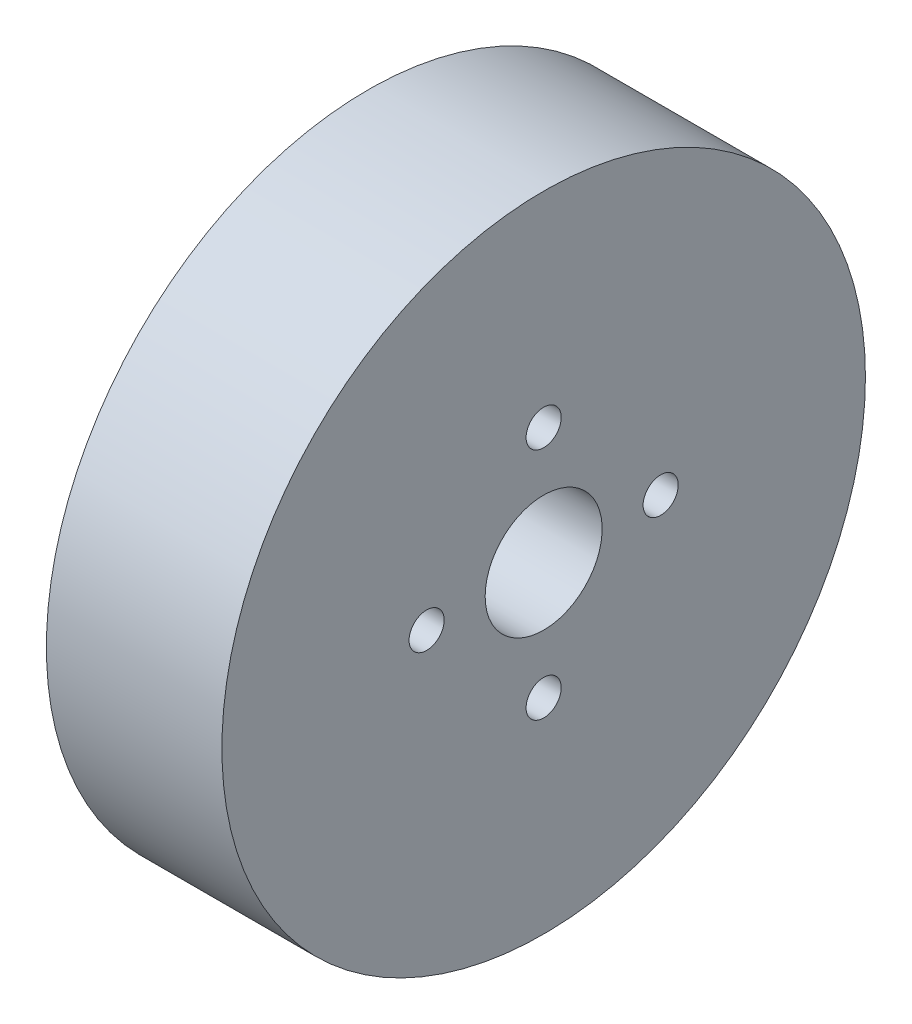
from build123d import *

# Parameters (mm, degrees)
SKETCH_1_R          = 27.5
EXTRUDE_1_DEPTH     = 15
CUT_EXTRUDE_1_REACH = 65.997
SKETCH_2_R          = 5
SKETCH_2_R_2        = 1.5


with BuildPart() as part:
    # 草图1 → 凸台-拉伸1 (new body)
    with BuildSketch(Plane(origin=(0, 0, 0), x_dir=(0, 0, -1), z_dir=(1, 0, 0))):
        with Locations((-18.795257752, 14.06192285)):
            Circle(SKETCH_1_R)
    extrude(amount=EXTRUDE_1_DEPTH)

    # 草图2 → 切除-拉伸1 (cut, up to next)
    with BuildSketch(Plane.ZY, mode=Mode.PRIVATE) as cut_extrude_1_sk1:
        with Locations((18.795257752, 14.06192285)):
            Circle(SKETCH_2_R)
    cut_extrude_1_tool1 = extrude(cut_extrude_1_sk1.sketch, amount=-CUT_EXTRUDE_1_REACH, mode=Mode.PRIVATE) & part.part
    # 草图2 → 切除-拉伸1 (cut, up to next)
    with BuildSketch(Plane.ZY, mode=Mode.PRIVATE) as cut_extrude_1_sk2:
        with Locations((18.795257752, 24.06192285)):
            Circle(SKETCH_2_R_2)
    cut_extrude_1_tool2 = extrude(cut_extrude_1_sk2.sketch, amount=-CUT_EXTRUDE_1_REACH, mode=Mode.PRIVATE) & part.part
    # 草图2 → 切除-拉伸1 (cut, up to next)
    with BuildSketch(Plane.ZY, mode=Mode.PRIVATE) as cut_extrude_1_sk3:
        with Locations((28.795257752, 14.06192285)):
            Circle(SKETCH_2_R_2)
    cut_extrude_1_tool3 = extrude(cut_extrude_1_sk3.sketch, amount=-CUT_EXTRUDE_1_REACH, mode=Mode.PRIVATE) & part.part
    # 草图2 → 切除-拉伸1 (cut, up to next)
    with BuildSketch(Plane.ZY, mode=Mode.PRIVATE) as cut_extrude_1_sk4:
        with Locations((8.795257752, 14.06192285)):
            Circle(SKETCH_2_R_2)
    cut_extrude_1_tool4 = extrude(cut_extrude_1_sk4.sketch, amount=-CUT_EXTRUDE_1_REACH, mode=Mode.PRIVATE) & part.part
    # 草图2 → 切除-拉伸1 (cut, up to next)
    with BuildSketch(Plane.ZY, mode=Mode.PRIVATE) as cut_extrude_1_sk5:
        with Locations((18.795257752, 4.06192285)):
            Circle(SKETCH_2_R_2)
    cut_extrude_1_tool5 = extrude(cut_extrude_1_sk5.sketch, amount=-CUT_EXTRUDE_1_REACH, mode=Mode.PRIVATE) & part.part
    add(cut_extrude_1_tool1.solids().sort_by_distance((0, 14.061923, 18.795258))[0], mode=Mode.SUBTRACT)
    add(cut_extrude_1_tool2.solids().sort_by_distance((0, 24.061923, 18.795258))[0], mode=Mode.SUBTRACT)
    add(cut_extrude_1_tool3.solids().sort_by_distance((0, 14.061923, 28.795258))[0], mode=Mode.SUBTRACT)
    add(cut_extrude_1_tool4.solids().sort_by_distance((0, 14.061923, 8.795258))[0], mode=Mode.SUBTRACT)
    add(cut_extrude_1_tool5.solids().sort_by_distance((0, 4.061923, 18.795258))[0], mode=Mode.SUBTRACT)


solid = part.part
